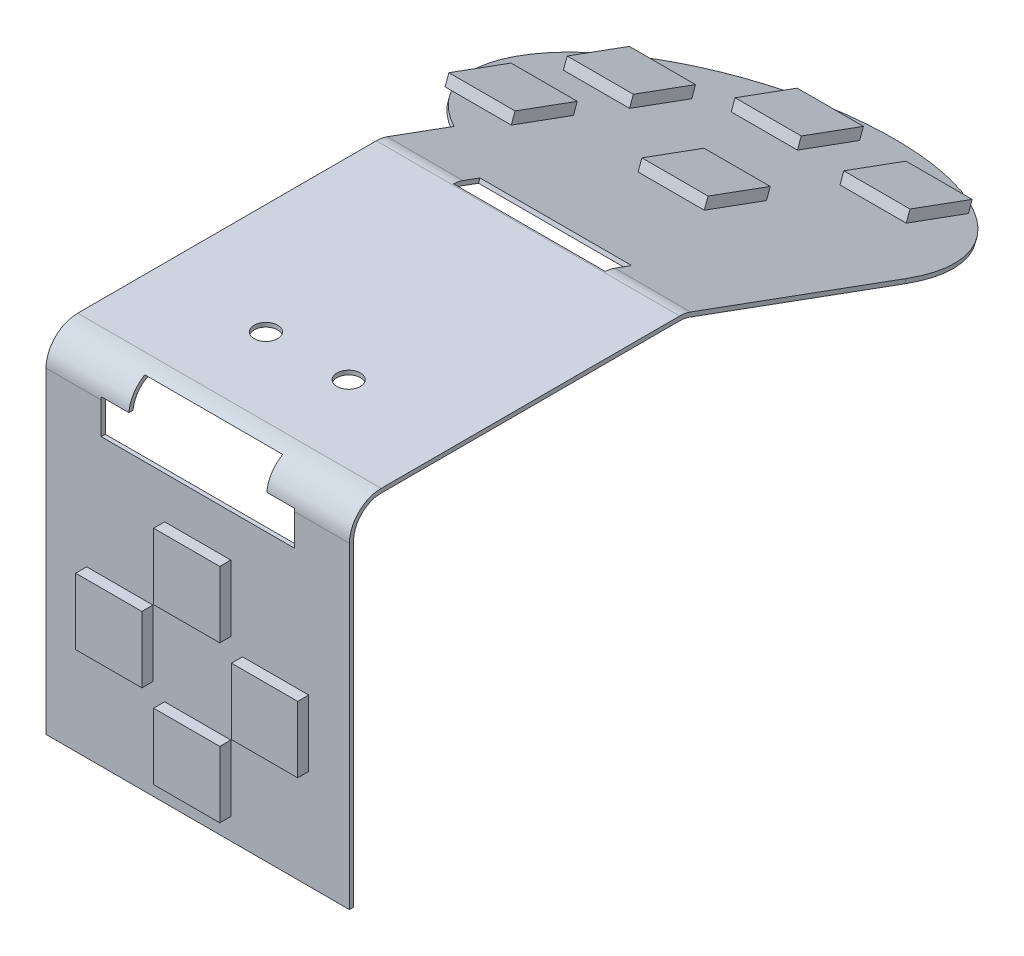
from build123d import *

# Parameters (mm, degrees)
EXTRUDE_1_DEPTH     = 22
CUT_EXTRUDE_1_DEPTH = 4
CUT_EXTRUDE_2_DEPTH = 64.319089808
SKETCH_3_3_R        = 14
EXTRUDE_2_DEPTH     = 0.3
SKETCH_4_W          = 4.8
SKETCH_4_H          = 4.8
EXTRUDE_3_DEPTH     = 0.8
SKETCH_5_R          = 0.85
CUT_EXTRUDE_3_DEPTH = 63.897702188
SKETCH_6_W          = 11
SKETCH_6_H          = 2
CUT_EXTRUDE_4_DEPTH = 1
SKETCH_7_W          = 4.8
SKETCH_7_H          = 4.8
EXTRUDE_4_DEPTH     = 0.8


with BuildPart() as part:
    # 草图1 → 凸台-拉伸1 (new body)
    with BuildSketch(Plane(origin=(0, 0, 0), x_dir=(0, 0, -1), z_dir=(1, 0, 0))):
        with BuildLine():
            Line((0, -25), (0, -2))
            ThreePointArc((0, -2), (0.585786438, -0.585786438), (2, 0))
            Line((2, 0), (23.64572618, 0))
            ThreePointArc((23.64572618, 0), (23.99456936, -0.030657867), (24.332717753, -0.121691565))
            Line((24.332717753, -0.121691565), (52.174626532, -10.304873595))
            Line((52.174626532, -10.304873595), (52.277675268, -10.023127329))
            Line((52.277675268, -10.023127329), (24.435766489, 0.160054701))
            ThreePointArc((24.435766489, 0.160054701), (24.046895837, 0.264743453), (23.64572618, 0.3))
            Line((23.64572618, 0.3), (2, 0.3))
            ThreePointArc((2, 0.3), (0.373654403, -0.373654403), (-0.3, -2))
            Line((-0.3, -2), (-0.3, -25))
            Line((-0.3, -25), (0, -25))
        make_face()
    extrude(amount=EXTRUDE_1_DEPTH)

    # 草图2 → 切除-拉伸1 (cut)
    with BuildSketch(Plane.XY.offset(0.3)):
        Polygon((4, -4.3), (18, -4.3), (18, -1.8), (16, -1.8), (16, 0), (6, 0), (6, -1.8), (4, -1.8), align=None)
    extrude(amount=-CUT_EXTRUDE_1_DEPTH, mode=Mode.SUBTRACT)

    # 草图3 → 切除-拉伸2 (cut, through all)
    with BuildSketch(Plane(origin=(0, 8.024038665, -2.934793264), x_dir=(1, 0, 0), z_dir=(0, 0.9391542177229502, -0.3434957864853564))):
        with BuildLine():
            ThreePointArc((13.196152423, 52.539701225), (19.591939741, 47.38998358), (22, 39.539701225))
            Line((22, 39.539701225), (22, 52.539701225))
            Line((22, 52.539701225), (13.196152423, 52.539701225))
        make_face()
        with BuildLine():
            ThreePointArc((0, 51.028826518), (1.358818231, 51.864258204), (2.803847577, 52.539701225))
            Line((2.803847577, 52.539701225), (0, 52.539701225))
            Line((0, 52.539701225), (0, 51.028826518))
        make_face()
    extrude(amount=-CUT_EXTRUDE_2_DEPTH, mode=Mode.SUBTRACT)

    # 草图3<3> → 凸台-拉伸2 (add)
    with BuildSketch(Plane(origin=(0, 8.024038665, -2.934793264), x_dir=(1, 0, 0), z_dir=(0, 0.9391542177229502, -0.3434957864853564))):
        with Locations((8, 39.539701225)):
            Circle(SKETCH_3_3_R)
    extrude(amount=-EXTRUDE_2_DEPTH)

    # 草图4 → 凸台-拉伸3 (add)
    with BuildSketch(Plane.XY.offset(0.3)):
        with Locations((11, -9.75)):
            Rectangle(SKETCH_4_W, SKETCH_4_H)
        with Locations((11, -21.05)):
            Rectangle(SKETCH_4_W, SKETCH_4_H)
        with Locations((5.35, -15.4)):
            Rectangle(SKETCH_4_W, SKETCH_4_H)
        with Locations((16.65, -15.4)):
            Rectangle(SKETCH_4_W, SKETCH_4_H)
    extrude(amount=EXTRUDE_3_DEPTH)

    # 草图5 → 切除-拉伸3 (cut, through all)
    with BuildSketch(Plane(origin=(0, 0.3, 0), x_dir=(1, 0, 0), z_dir=(0, 1, 0))):
        with Locations((8, 7.64572618)):
            Circle(SKETCH_5_R)
        with Locations((14, 7.64572618)):
            Circle(SKETCH_5_R)
    extrude(amount=-CUT_EXTRUDE_3_DEPTH, mode=Mode.SUBTRACT)

    # 草图6 → 切除-拉伸4 (cut)
    with BuildSketch(Plane(origin=(0, 8.024038665, -2.934793264), x_dir=(1, 0, 0), z_dir=(0, 0.9391542177229502, -0.3434957864853564))):
        with Locations((11, 23.2)):
            Rectangle(SKETCH_6_W, SKETCH_6_H)
    extrude(amount=-CUT_EXTRUDE_4_DEPTH, mode=Mode.SUBTRACT)

    # 草图7 → 凸台-拉伸4 (add)
    with BuildSketch(Plane(origin=(0, 8.024038665, -2.934793264), x_dir=(1, 0, 0), z_dir=(0, 0.9391542177229502, -0.3434957864853564))):
        with Locations((9.738477049, 36.851443585)):
            Rectangle(SKETCH_7_W, SKETCH_7_H)
        with Locations((14.118767038, 47.774445204)):
            Rectangle(SKETCH_7_W, SKETCH_7_H)
        with Locations((5.219570287, 48.855656024)):
            Rectangle(SKETCH_7_W, SKETCH_7_H)
        with Locations((-1.489481468, 43.037611303)):
            Rectangle(SKETCH_7_W, SKETCH_7_H)
        with Locations((-1.651961899, 34.079108149)):
            Rectangle(SKETCH_7_W, SKETCH_7_H)
    extrude(amount=EXTRUDE_4_DEPTH)


solid = part.part
